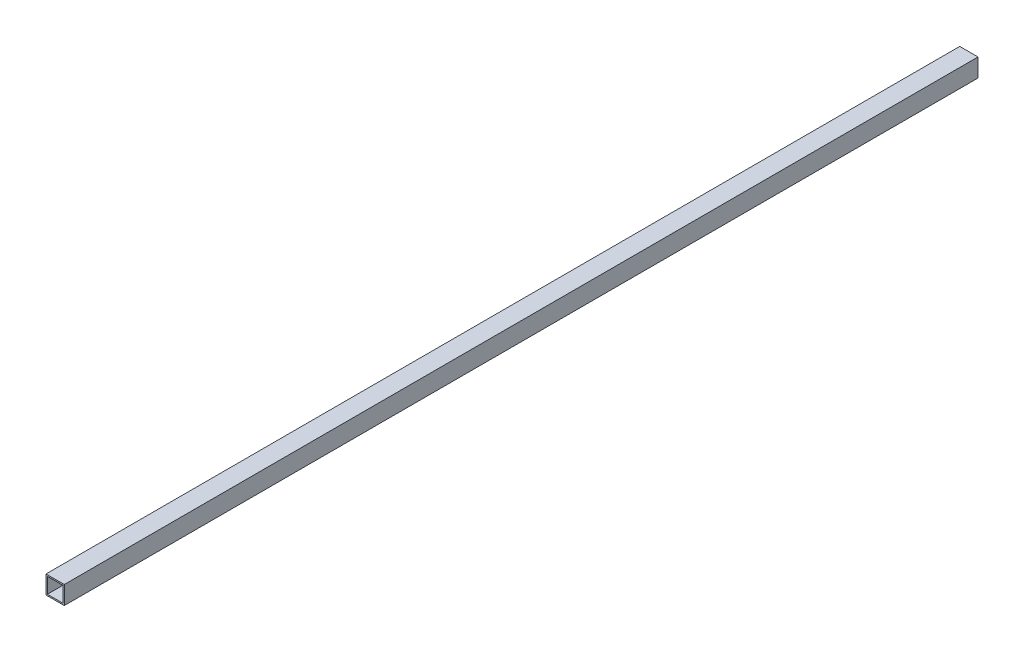
from build123d import *

# Parameters (mm, degrees)
SKETCH1_W           = 40
SKETCH1_H           = 40
BOSS_EXTRUDE1_DEPTH = 2000
SKETCH2_W           = 34
SKETCH2_H           = 34
CUT_EXTRUDE1_DEPTH  = 2000


with BuildPart() as part:
    # Sketch1 → Boss-Extrude1 (new body)
    with BuildSketch(Plane.XY):
        Rectangle(SKETCH1_W, SKETCH1_H)
    extrude(amount=BOSS_EXTRUDE1_DEPTH)

    # Sketch2 → Cut-Extrude1 (cut)
    with BuildSketch(Plane(origin=(0, 0, 0), x_dir=(-1, 0, 0), z_dir=(0, 0, -1))):
        Rectangle(SKETCH2_W, SKETCH2_H)
    extrude(amount=-CUT_EXTRUDE1_DEPTH, mode=Mode.SUBTRACT)


solid = part.part
